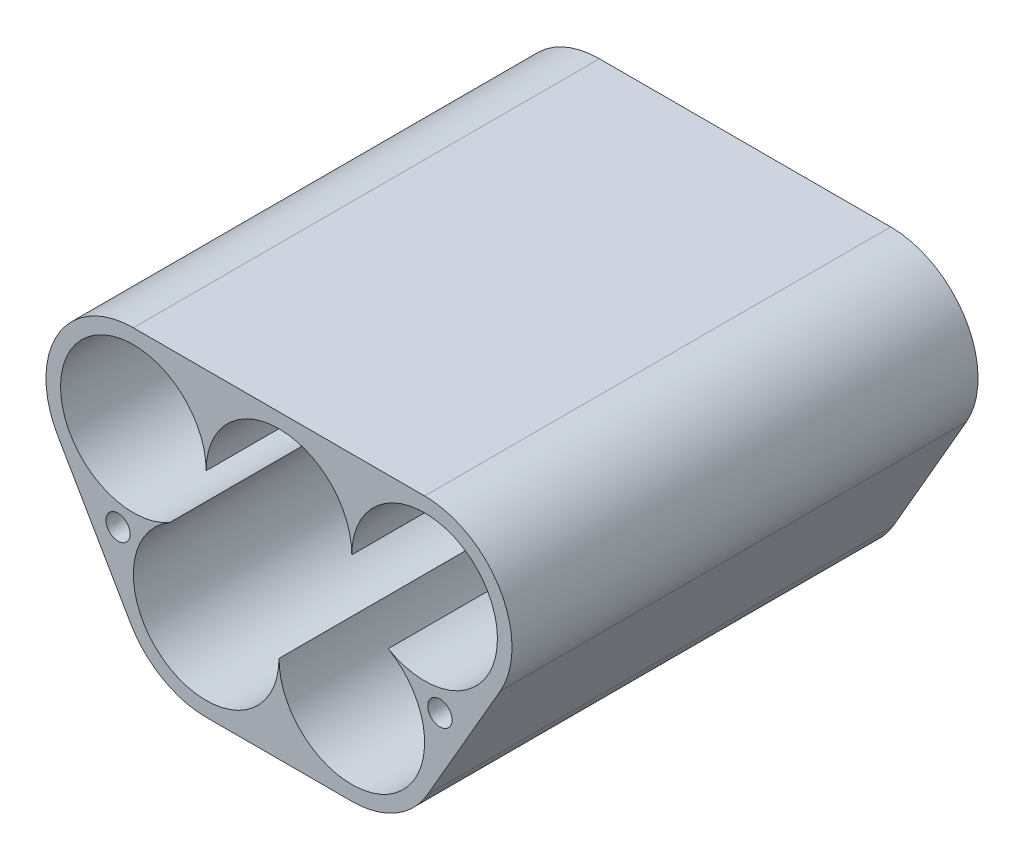
from build123d import *

# Parameters (mm, degrees)
BOSS_EXTRUDE1_DEPTH = 48
SKETCH2_R           = 1.25
CUT_EXTRUDE1_DEPTH  = 66.639750601


with BuildPart() as part:
    # Sketch1 → Boss-Extrude1 (new body)
    with BuildSketch(Plane.XY):
        with BuildLine():
            Line((7.5, -21.990381057), (22.5, -21.990381057))
            ThreePointArc((22.5, -21.990381057), (27, -20.784609691), (30.294228634, -17.490381057))
            Line((30.294228634, -17.490381057), (37.794228634, -4.5))
            ThreePointArc((37.794228634, -4.5), (37.794228634, 4.5), (30, 9))
            Line((30, 9), (0, 9))
            ThreePointArc((0, 9), (-7.794228634, 4.5), (-7.794228634, -4.5))
            Line((-7.794228634, -4.5), (-0.294228634, -17.490381057))
            ThreePointArc((-0.294228634, -17.490381057), (3, -20.784609691), (7.5, -21.990381057))
        make_face()
        with BuildLine():
            ThreePointArc((3.75, -6.495190528), (3.75, -19.485571585), (15, -12.990381057))
            ThreePointArc((15, -12.990381057), (26.25, -19.485571585), (26.25, -6.495190528))
            ThreePointArc((26.25, -6.495190528), (36.495190528, 3.75), (22.5, 0))
            ThreePointArc((22.5, 0), (15, 7.5), (7.5, 0))
            ThreePointArc((7.5, 0), (-6.495190528, 3.75), (3.75, -6.495190528))
        make_face(mode=Mode.SUBTRACT)
    extrude(amount=BOSS_EXTRUDE1_DEPTH)

    # Sketch2 → Cut-Extrude1 (cut, through all)
    with BuildSketch(Plane(origin=(0, 0, 0), x_dir=(-1, 0, 0), z_dir=(0, 0, -1))):
        with Locations((1.576056233, -9.570190528)):
            Circle(SKETCH2_R)
        with Locations((-31.574981029, -9.570190528)):
            Circle(SKETCH2_R)
    extrude(amount=-CUT_EXTRUDE1_DEPTH, mode=Mode.SUBTRACT)


solid = part.part
